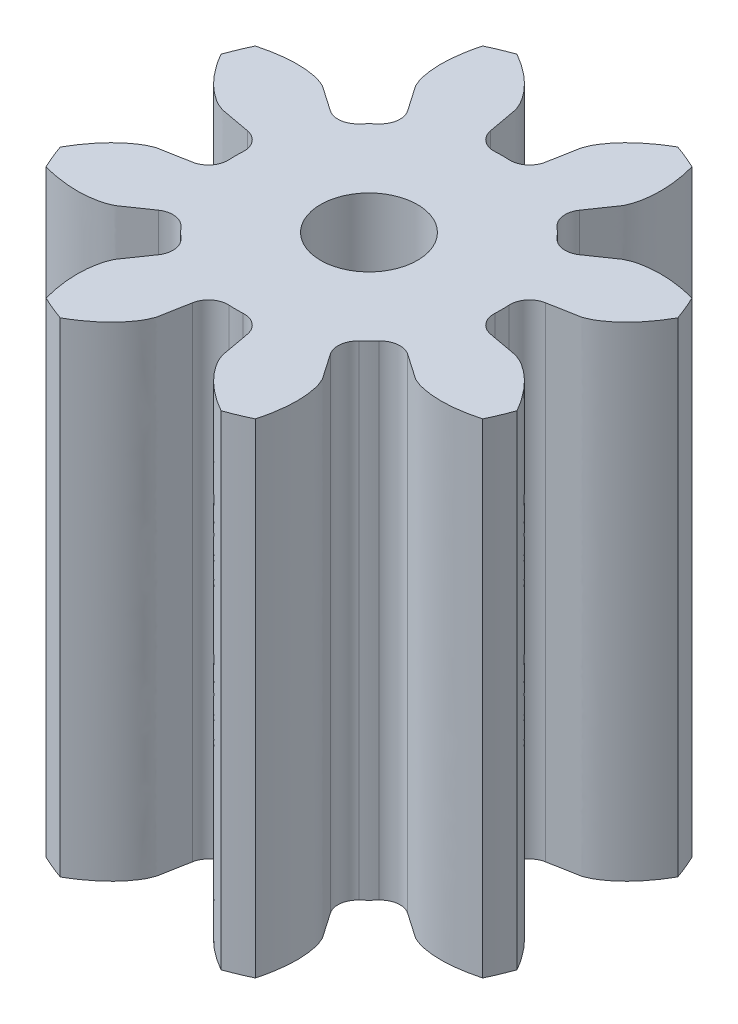
from build123d import *

# Parameters (mm, degrees)
ESBO_O1_R                = 0.5
RESSALTO_EXTRUS_O1_DEPTH = 5


with BuildPart() as part:
    # Esboço1 → Ressalto-extrusão1 (new body)
    with BuildSketch(Plane.XZ.offset(5)):
        with BuildLine():
            ThreePointArc((0.88816946, -1.287165167), (0.853822869, -1.148958648), (0.919306865, -1.022496889))
            ThreePointArc((0.919306865, -1.022496889), (0.972271824, -0.972271824), (1.022496889, -0.919306865))
            ThreePointArc((1.022496889, -0.919306865), (1.148958648, -0.853822869), (1.287165167, -0.88816946))
            add(Edge.make_bspline(
                [(1.287165167, -0.88816946), (1.383791359, -0.954882813), (1.556408334, -1.073982269), (1.549215881, -1.068804746), (1.613247697, -1.099886307), (1.689593731, -1.118505632), (1.818337157, -1.137704346), (2.003981613, -1.135749512), (2.169907523, -1.103671613), (2.254570833, -1.080236252)],
                knots=[0.030903034, 0.030903034, 0.030903034, 0.030903034, 0.091208758, 0.151514483, 0.272125931, 0.39273738, 0.513348828, 0.754571725, 0.995794622, 0.995794622, 0.995794622, 0.995794622], degree=3))
            ThreePointArc((2.254570833, -1.080236252), (2.309698831, -0.956708581), (2.358064704, -0.830379945))
            add(Edge.make_bspline(
                [(1.538193866, -0.28213257), (1.653692366, -0.303284141), (1.859967032, -0.341126742), (1.851220139, -0.339701972), (1.918475453, -0.36300132), (1.985626101, -0.403820267), (2.090236992, -0.481280077), (2.220125169, -0.613932807), (2.314770006, -0.753942643), (2.358064704, -0.830379945)],
                knots=[0.030903034, 0.030903034, 0.030903034, 0.030903034, 0.091208758, 0.151514483, 0.272125931, 0.39273738, 0.513348828, 0.754571725, 0.995794622, 0.995794622, 0.995794622, 0.995794622], degree=3))
            ThreePointArc((1.538193866, -0.28213257), (1.416180392, -0.208692511), (1.373062602, -0.072966366))
            ThreePointArc((1.373062602, -0.072966366), (1.375, 0), (1.373062602, 0.072966366))
            ThreePointArc((1.373062602, 0.072966366), (1.416180392, 0.208692511), (1.538193866, 0.28213257))
            add(Edge.make_bspline(
                [(1.538193866, 0.28213257), (1.653692366, 0.303284141), (1.859967032, 0.341126742), (1.851220139, 0.339701972), (1.918475453, 0.36300132), (1.985626101, 0.403820267), (2.090236992, 0.481280077), (2.220125169, 0.613932807), (2.314770006, 0.753942643), (2.358064704, 0.830379945)],
                knots=[0.030903034, 0.030903034, 0.030903034, 0.030903034, 0.091208758, 0.151514483, 0.272125931, 0.39273738, 0.513348828, 0.754571725, 0.995794622, 0.995794622, 0.995794622, 0.995794622], degree=3))
            ThreePointArc((2.358064704, 0.830379945), (2.309698831, 0.956708581), (2.254570833, 1.080236252))
            add(Edge.make_bspline(
                [(1.287165167, 0.88816946), (1.383791359, 0.954882813), (1.556408334, 1.073982269), (1.549215881, 1.068804746), (1.613247697, 1.099886307), (1.689593731, 1.118505632), (1.818337157, 1.137704346), (2.003981613, 1.135749512), (2.169907523, 1.103671613), (2.254570833, 1.080236252)],
                knots=[0.030903034, 0.030903034, 0.030903034, 0.030903034, 0.091208758, 0.151514483, 0.272125931, 0.39273738, 0.513348828, 0.754571725, 0.995794622, 0.995794622, 0.995794622, 0.995794622], degree=3))
            ThreePointArc((1.287165167, 0.88816946), (1.148958648, 0.853822869), (1.022496889, 0.919306865))
            ThreePointArc((1.022496889, 0.919306865), (0.972271824, 0.972271824), (0.919306865, 1.022496889))
            ThreePointArc((0.919306865, 1.022496889), (0.853822869, 1.148958648), (0.88816946, 1.287165167))
            add(Edge.make_bspline(
                [(0.88816946, 1.287165167), (0.954882813, 1.383791359), (1.073982269, 1.556408334), (1.068804746, 1.549215881), (1.099886307, 1.613247697), (1.118505632, 1.689593731), (1.137704346, 1.818337157), (1.135749512, 2.003981613), (1.103671613, 2.169907523), (1.080236252, 2.254570833)],
                knots=[0.030903034, 0.030903034, 0.030903034, 0.030903034, 0.091208758, 0.151514483, 0.272125931, 0.39273738, 0.513348828, 0.754571725, 0.995794622, 0.995794622, 0.995794622, 0.995794622], degree=3))
            ThreePointArc((1.080236252, 2.254570833), (0.956708581, 2.309698831), (0.830379945, 2.358064704))
            add(Edge.make_bspline(
                [(0.28213257, 1.538193866), (0.303284141, 1.653692366), (0.341126742, 1.859967032), (0.339701972, 1.851220139), (0.36300132, 1.918475453), (0.403820267, 1.985626101), (0.481280077, 2.090236992), (0.613932807, 2.220125169), (0.753942643, 2.314770006), (0.830379945, 2.358064704)],
                knots=[0.030903034, 0.030903034, 0.030903034, 0.030903034, 0.091208758, 0.151514483, 0.272125931, 0.39273738, 0.513348828, 0.754571725, 0.995794622, 0.995794622, 0.995794622, 0.995794622], degree=3))
            ThreePointArc((0.28213257, 1.538193866), (0.208692511, 1.416180392), (0.072966366, 1.373062602))
            ThreePointArc((0.072966366, 1.373062602), (0, 1.375), (-0.072966366, 1.373062602))
            ThreePointArc((-0.072966366, 1.373062602), (-0.208692511, 1.416180392), (-0.28213257, 1.538193866))
            add(Edge.make_bspline(
                [(-0.28213257, 1.538193866), (-0.303284141, 1.653692366), (-0.341126742, 1.859967032), (-0.339701972, 1.851220139), (-0.36300132, 1.918475453), (-0.403820267, 1.985626101), (-0.481280077, 2.090236992), (-0.613932807, 2.220125169), (-0.753942643, 2.314770006), (-0.830379945, 2.358064704)],
                knots=[0.030903034, 0.030903034, 0.030903034, 0.030903034, 0.091208758, 0.151514483, 0.272125931, 0.39273738, 0.513348828, 0.754571725, 0.995794622, 0.995794622, 0.995794622, 0.995794622], degree=3))
            ThreePointArc((-0.830379945, 2.358064704), (-0.956708581, 2.309698831), (-1.080236252, 2.254570833))
            add(Edge.make_bspline(
                [(-0.88816946, 1.287165167), (-0.954882813, 1.383791359), (-1.073982269, 1.556408334), (-1.068804746, 1.549215881), (-1.099886307, 1.613247697), (-1.118505632, 1.689593731), (-1.137704346, 1.818337157), (-1.135749512, 2.003981613), (-1.103671613, 2.169907523), (-1.080236252, 2.254570833)],
                knots=[0.030903034, 0.030903034, 0.030903034, 0.030903034, 0.091208758, 0.151514483, 0.272125931, 0.39273738, 0.513348828, 0.754571725, 0.995794622, 0.995794622, 0.995794622, 0.995794622], degree=3))
            ThreePointArc((-0.88816946, 1.287165167), (-0.853822869, 1.148958648), (-0.919306865, 1.022496889))
            ThreePointArc((-0.919306865, 1.022496889), (-0.972271824, 0.972271824), (-1.022496889, 0.919306865))
            ThreePointArc((-1.022496889, 0.919306865), (-1.148958648, 0.853822869), (-1.287165167, 0.88816946))
            add(Edge.make_bspline(
                [(-1.287165167, 0.88816946), (-1.383791359, 0.954882813), (-1.556408334, 1.073982269), (-1.549215881, 1.068804746), (-1.613247697, 1.099886307), (-1.689593731, 1.118505632), (-1.818337157, 1.137704346), (-2.003981613, 1.135749512), (-2.169907523, 1.103671613), (-2.254570833, 1.080236252)],
                knots=[0.030903034, 0.030903034, 0.030903034, 0.030903034, 0.091208758, 0.151514483, 0.272125931, 0.39273738, 0.513348828, 0.754571725, 0.995794622, 0.995794622, 0.995794622, 0.995794622], degree=3))
            ThreePointArc((-2.254570833, 1.080236252), (-2.309698831, 0.956708581), (-2.358064704, 0.830379945))
            add(Edge.make_bspline(
                [(-1.538193866, 0.28213257), (-1.653692366, 0.303284141), (-1.859967032, 0.341126742), (-1.851220139, 0.339701972), (-1.918475453, 0.36300132), (-1.985626101, 0.403820267), (-2.090236992, 0.481280077), (-2.220125169, 0.613932807), (-2.314770006, 0.753942643), (-2.358064704, 0.830379945)],
                knots=[0.030903034, 0.030903034, 0.030903034, 0.030903034, 0.091208758, 0.151514483, 0.272125931, 0.39273738, 0.513348828, 0.754571725, 0.995794622, 0.995794622, 0.995794622, 0.995794622], degree=3))
            ThreePointArc((-1.538193866, 0.28213257), (-1.416180392, 0.208692511), (-1.373062602, 0.072966366))
            ThreePointArc((-1.373062602, 0.072966366), (-1.375, 0), (-1.373062602, -0.072966366))
            ThreePointArc((-1.373062602, -0.072966366), (-1.416180392, -0.208692511), (-1.538193866, -0.28213257))
            add(Edge.make_bspline(
                [(-1.538193866, -0.28213257), (-1.653692366, -0.303284141), (-1.859967032, -0.341126742), (-1.851220139, -0.339701972), (-1.918475453, -0.36300132), (-1.985626101, -0.403820267), (-2.090236992, -0.481280077), (-2.220125169, -0.613932807), (-2.314770006, -0.753942643), (-2.358064704, -0.830379945)],
                knots=[0.030903034, 0.030903034, 0.030903034, 0.030903034, 0.091208758, 0.151514483, 0.272125931, 0.39273738, 0.513348828, 0.754571725, 0.995794622, 0.995794622, 0.995794622, 0.995794622], degree=3))
            ThreePointArc((-2.358064704, -0.830379945), (-2.309698831, -0.956708581), (-2.254570833, -1.080236252))
            add(Edge.make_bspline(
                [(-1.287165167, -0.88816946), (-1.383791359, -0.954882813), (-1.556408334, -1.073982269), (-1.549215881, -1.068804746), (-1.613247697, -1.099886307), (-1.689593731, -1.118505632), (-1.818337157, -1.137704346), (-2.003981613, -1.135749512), (-2.169907523, -1.103671613), (-2.254570833, -1.080236252)],
                knots=[0.030903034, 0.030903034, 0.030903034, 0.030903034, 0.091208758, 0.151514483, 0.272125931, 0.39273738, 0.513348828, 0.754571725, 0.995794622, 0.995794622, 0.995794622, 0.995794622], degree=3))
            ThreePointArc((-1.287165167, -0.88816946), (-1.148958648, -0.853822869), (-1.022496889, -0.919306865))
            ThreePointArc((-1.022496889, -0.919306865), (-0.972271824, -0.972271824), (-0.919306865, -1.022496889))
            ThreePointArc((-0.919306865, -1.022496889), (-0.853822869, -1.148958648), (-0.88816946, -1.287165167))
            add(Edge.make_bspline(
                [(-0.88816946, -1.287165167), (-0.954882813, -1.383791359), (-1.073982269, -1.556408334), (-1.068804746, -1.549215881), (-1.099886307, -1.613247697), (-1.118505632, -1.689593731), (-1.137704346, -1.818337157), (-1.135749512, -2.003981613), (-1.103671613, -2.169907523), (-1.080236252, -2.254570833)],
                knots=[0.030903034, 0.030903034, 0.030903034, 0.030903034, 0.091208758, 0.151514483, 0.272125931, 0.39273738, 0.513348828, 0.754571725, 0.995794622, 0.995794622, 0.995794622, 0.995794622], degree=3))
            ThreePointArc((-1.080236252, -2.254570833), (-0.956708581, -2.309698831), (-0.830379945, -2.358064704))
            add(Edge.make_bspline(
                [(-0.28213257, -1.538193866), (-0.303284141, -1.653692366), (-0.341126742, -1.859967032), (-0.339701972, -1.851220139), (-0.36300132, -1.918475453), (-0.403820267, -1.985626101), (-0.481280077, -2.090236992), (-0.613932807, -2.220125169), (-0.753942643, -2.314770006), (-0.830379945, -2.358064704)],
                knots=[0.030903034, 0.030903034, 0.030903034, 0.030903034, 0.091208758, 0.151514483, 0.272125931, 0.39273738, 0.513348828, 0.754571725, 0.995794622, 0.995794622, 0.995794622, 0.995794622], degree=3))
            ThreePointArc((-0.28213257, -1.538193866), (-0.208692511, -1.416180392), (-0.072966366, -1.373062602))
            ThreePointArc((-0.072966366, -1.373062602), (0, -1.375), (0.072966366, -1.373062602))
            ThreePointArc((0.072966366, -1.373062602), (0.208692511, -1.416180392), (0.28213257, -1.538193866))
            add(Edge.make_bspline(
                [(0.28213257, -1.538193866), (0.303284141, -1.653692366), (0.341126742, -1.859967032), (0.339701972, -1.851220139), (0.36300132, -1.918475453), (0.403820267, -1.985626101), (0.481280077, -2.090236992), (0.613932807, -2.220125169), (0.753942643, -2.314770006), (0.830379945, -2.358064704)],
                knots=[0.030903034, 0.030903034, 0.030903034, 0.030903034, 0.091208758, 0.151514483, 0.272125931, 0.39273738, 0.513348828, 0.754571725, 0.995794622, 0.995794622, 0.995794622, 0.995794622], degree=3))
            ThreePointArc((0.830379945, -2.358064704), (0.956708581, -2.309698831), (1.080236252, -2.254570833))
            add(Edge.make_bspline(
                [(0.88816946, -1.287165167), (0.954882813, -1.383791359), (1.073982269, -1.556408334), (1.068804746, -1.549215881), (1.099886307, -1.613247697), (1.118505632, -1.689593731), (1.137704346, -1.818337157), (1.135749512, -2.003981613), (1.103671613, -2.169907523), (1.080236252, -2.254570833)],
                knots=[0.030903034, 0.030903034, 0.030903034, 0.030903034, 0.091208758, 0.151514483, 0.272125931, 0.39273738, 0.513348828, 0.754571725, 0.995794622, 0.995794622, 0.995794622, 0.995794622], degree=3))
        make_face()
        with Locations(Location((0, 0, 0), (0, 0, 90))):
            Circle(ESBO_O1_R, mode=Mode.SUBTRACT)
    extrude(amount=-RESSALTO_EXTRUS_O1_DEPTH)


solid = part.part
